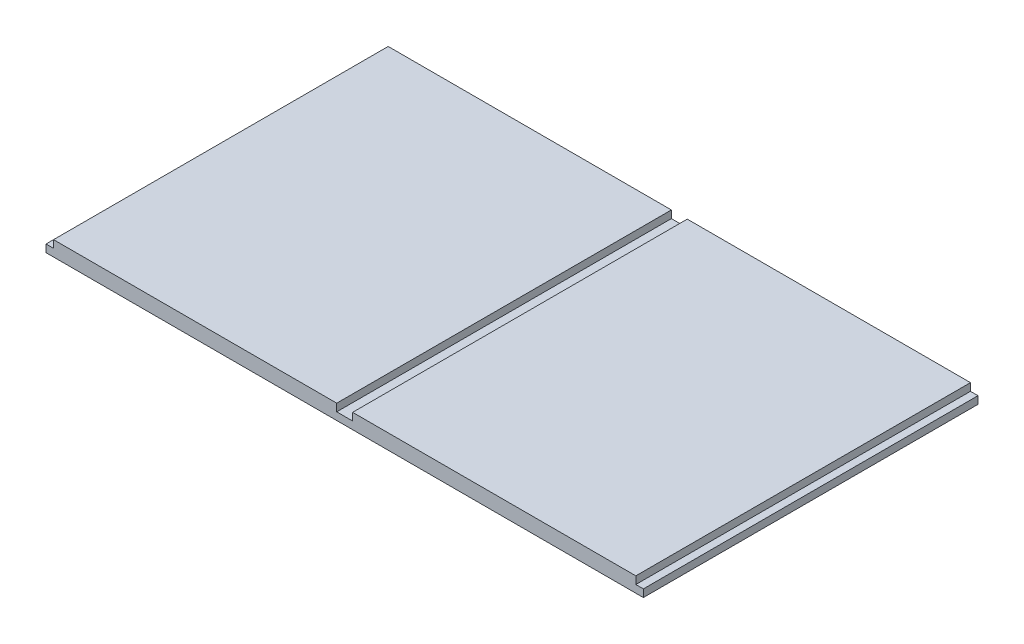
from build123d import *

# Parameters (mm, degrees)
SKETCH1_W           = 714
SKETCH1_H           = 400
BOSS_EXTRUDE1_DEPTH = 18
SKETCH2_W           = 9
SKETCH2_H           = 400
CUT_EXTRUDE1_DEPTH  = 9
SKETCH3_W           = 19
SKETCH3_H           = 400
CUT_EXTRUDE2_DEPTH  = 9


with BuildPart() as part:
    # Sketch1 → Boss-Extrude1 (new body)
    with BuildSketch(Plane(origin=(0, 0, 0), x_dir=(1, 0, 0), z_dir=(0, 1, 0))):
        Rectangle(SKETCH1_W, SKETCH1_H)
    extrude(amount=BOSS_EXTRUDE1_DEPTH)

    # Sketch2 → Cut-Extrude1 (cut)
    with BuildSketch(Plane(origin=(0, 18, 0), x_dir=(1, 0, 0), z_dir=(0, 1, 0))):
        with Locations((352.5, 0)):
            Rectangle(SKETCH2_W, SKETCH2_H)
        with Locations((-352.5, 0)):
            Rectangle(SKETCH2_W, SKETCH2_H)
    extrude(amount=-CUT_EXTRUDE1_DEPTH, mode=Mode.SUBTRACT)

    # Sketch3 → Cut-Extrude2 (cut)
    with BuildSketch(Plane(origin=(0, 18, 0), x_dir=(1, 0, 0), z_dir=(0, 1, 0))):
        Rectangle(SKETCH3_W, SKETCH3_H)
    extrude(amount=-CUT_EXTRUDE2_DEPTH, mode=Mode.SUBTRACT)


solid = part.part
